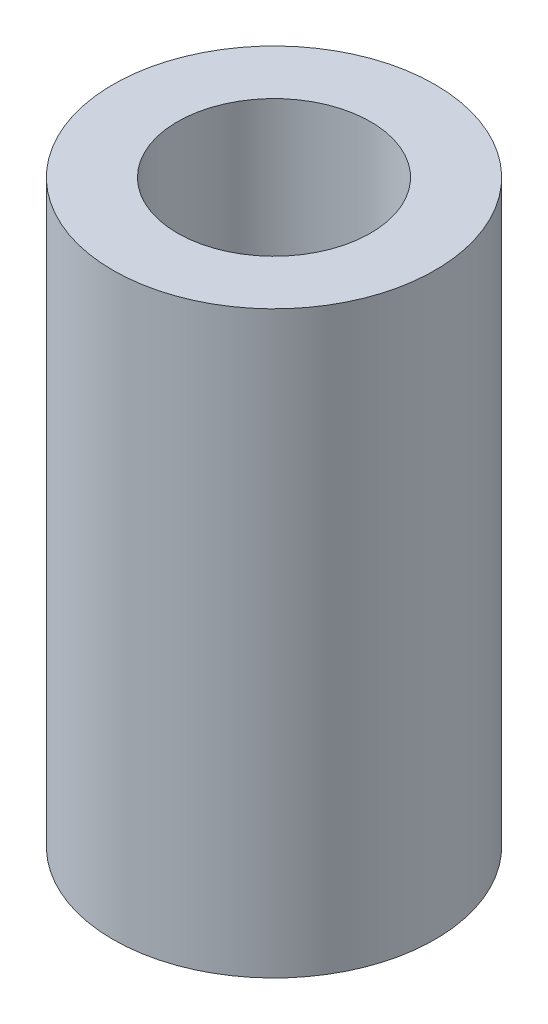
from build123d import *

# Parameters (mm, degrees)
ESBO_O1_R                     = 5
RESSALTO_EXTRUS_O1_DEPTH      = 3
ESBO_O2_R                     = 5
ESBO_O2_R_2                   = 3
RESSALTO_EXTRUS_O2_DEPTH      = 15
FURO_COM_FOLGA_DE_M2_51_D     = 2.9
FURO_COM_FOLGA_DE_M2_51_DEPTH = 4
FURO_COM_FOLGA_DE_M2_51_TIP   = 0.871247898


with BuildPart() as part:
    # Esboço1 → Ressalto-extrusão1 (new body)
    with BuildSketch(Plane(origin=(0, 0, 0), x_dir=(1, 0, 0), z_dir=(0, 1, 0))):
        with Locations(Location((0, 0, 0), (0, 0, 270))):
            Circle(ESBO_O1_R)
    extrude(amount=RESSALTO_EXTRUS_O1_DEPTH)

    # Esboço2 → Ressalto-extrusão2 (add)
    with BuildSketch(Plane(origin=(0, 3, 0), x_dir=(1, 0, 0), z_dir=(0, 1, 0))):
        with Locations(Location((0, 0, 0), (0, 0, 270))):
            Circle(ESBO_O2_R)
        with Locations(Location((0, 0, 0), (0, 0, 270))):
            Circle(ESBO_O2_R_2, mode=Mode.SUBTRACT)
    extrude(amount=RESSALTO_EXTRUS_O2_DEPTH)

    # Furo com folga de M2.51
    with Locations(Plane(origin=(0, 0, 0), x_dir=(0, 0, -1), z_dir=(0, -1, 0))):
        with Locations((0, 0)):
            Hole(FURO_COM_FOLGA_DE_M2_51_D / 2, depth=FURO_COM_FOLGA_DE_M2_51_DEPTH)
            with Locations((0, 0, -(FURO_COM_FOLGA_DE_M2_51_DEPTH + FURO_COM_FOLGA_DE_M2_51_TIP / 2))):  # 118° drill point
                Cone(0, FURO_COM_FOLGA_DE_M2_51_D / 2, FURO_COM_FOLGA_DE_M2_51_TIP, mode=Mode.SUBTRACT)


solid = part.part
